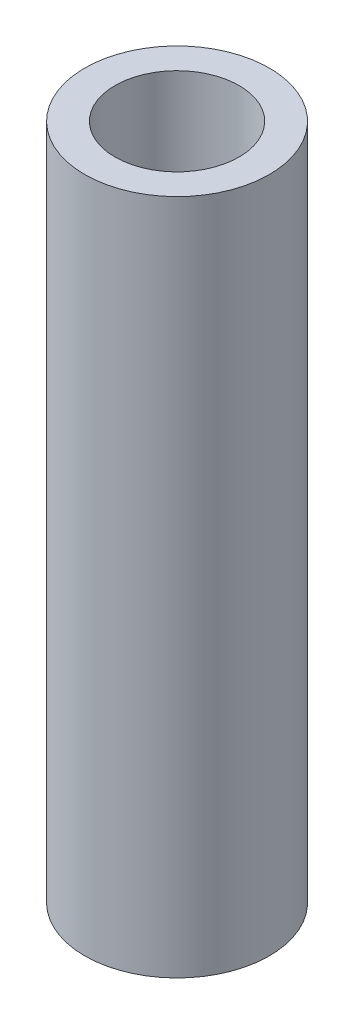
from build123d import *

# Parameters (mm, degrees)
SKETCH1_R            = 4.7625
BOSS_EXTRUDE1_DEPTH  = 34.925
M6_CLEARANCE_HOLE1_D = 6.4


with BuildPart() as part:
    # Sketch1 → Boss-Extrude1 (new body)
    with BuildSketch(Plane(origin=(0, 0, 0), x_dir=(1, 0, 0), z_dir=(0, 1, 0))):
        with Locations(Location((0, 0, 0), (0, 0, 270))):
            Circle(SKETCH1_R)
    extrude(amount=BOSS_EXTRUDE1_DEPTH)

    # M6 Clearance Hole1 (through all)
    with Locations(Plane(origin=(0, 34.925, 0), x_dir=(1, 0, 0), z_dir=(0, 1, 0))):
        with Locations((0, 0)):
            Hole(M6_CLEARANCE_HOLE1_D / 2)


solid = part.part
